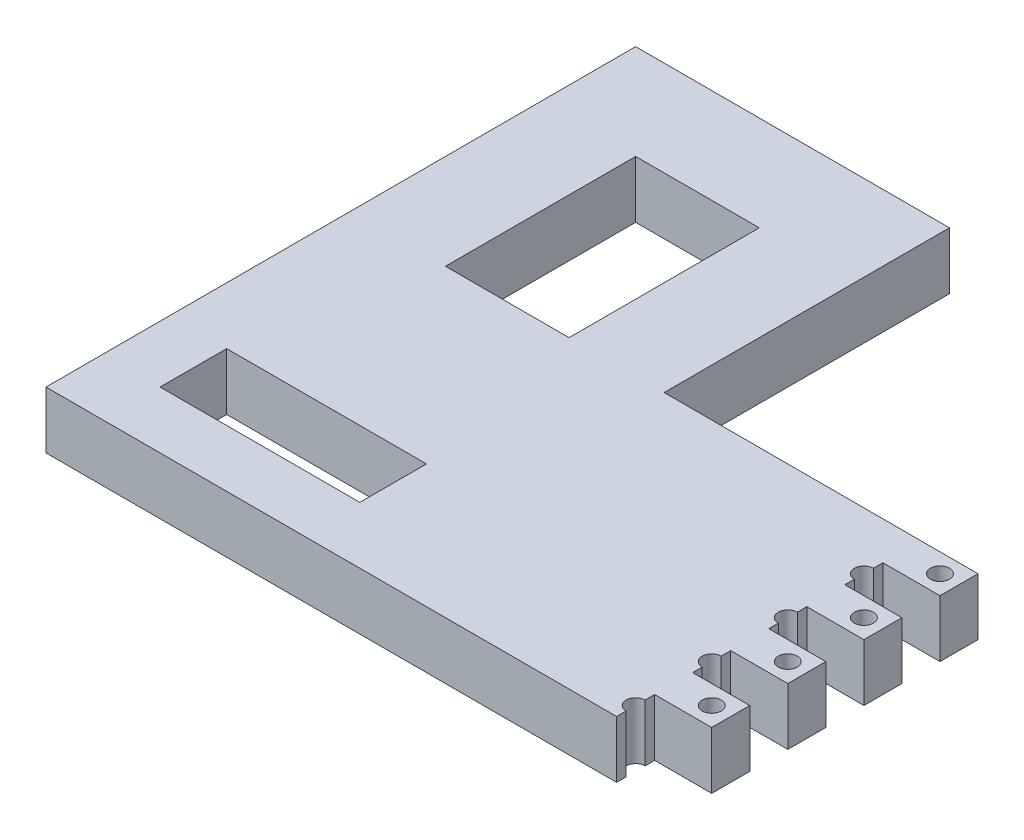
from build123d import *

# Parameters (mm, degrees)
BOSS_EXTRUDE1_DEPTH = 6
SKETCH2_W           = 21
SKETCH2_H           = 7
SKETCH2_W_2         = 13
SKETCH2_H_2         = 20
CUT_EXTRUDE1_DEPTH  = 91.752410436
SKETCH3_R           = 1
CUT_EXTRUDE2_DEPTH  = 91.752410436


with BuildPart() as part:
    # Sketch1 → Boss-Extrude1 (new body)
    with BuildSketch(Plane(origin=(0, 0, 0), x_dir=(1, 0, 0), z_dir=(0, 1, 0))):
        Polygon((33, 32), (66, 32), (66, 28), (60, 28), (60, 24), (66, 24), (66, 20), (60, 20), (60, 16), (66, 16), (66, 12), (60, 12), (60, 8), (66, 8), (66, 4), (60, 4), (60, 0), (0, 0), (0, 20), (0, 62), (33, 62), align=None)
    extrude(amount=BOSS_EXTRUDE1_DEPTH)

    # Sketch2 → Cut-Extrude1 (cut, through all)
    with BuildSketch(Plane(origin=(0, 6, 0), x_dir=(1, 0, 0), z_dir=(0, 1, 0))):
        with Locations((16.5, 9.5)):
            Rectangle(SKETCH2_W, SKETCH2_H)
        with Locations((16.5, 42)):
            Rectangle(SKETCH2_W_2, SKETCH2_H_2)
    extrude(amount=-CUT_EXTRUDE1_DEPTH, mode=Mode.SUBTRACT)

    # Sketch3 → Cut-Extrude2 (cut, through all)
    with BuildSketch(Plane(origin=(0, 6, 0), x_dir=(1, 0, 0), z_dir=(0, 1, 0))):
        with Locations(Location((64, 30, 0), (0, 0, 270))):
            Circle(SKETCH3_R)
        with Locations(Location((64, 22, 0), (0, 0, 270))):
            Circle(SKETCH3_R)
        with Locations(Location((64, 14, 0), (0, 0, 270))):
            Circle(SKETCH3_R)
        with Locations(Location((64, 6, 0), (0, 0, 270))):
            Circle(SKETCH3_R)
        with Locations((60, 26)):
            Circle(SKETCH3_R)
        with Locations((60, 18)):
            Circle(SKETCH3_R)
        with Locations((60, 10)):
            Circle(SKETCH3_R)
        with Locations((60, 2)):
            Circle(SKETCH3_R)
    extrude(amount=-CUT_EXTRUDE2_DEPTH, mode=Mode.SUBTRACT)


solid = part.part
